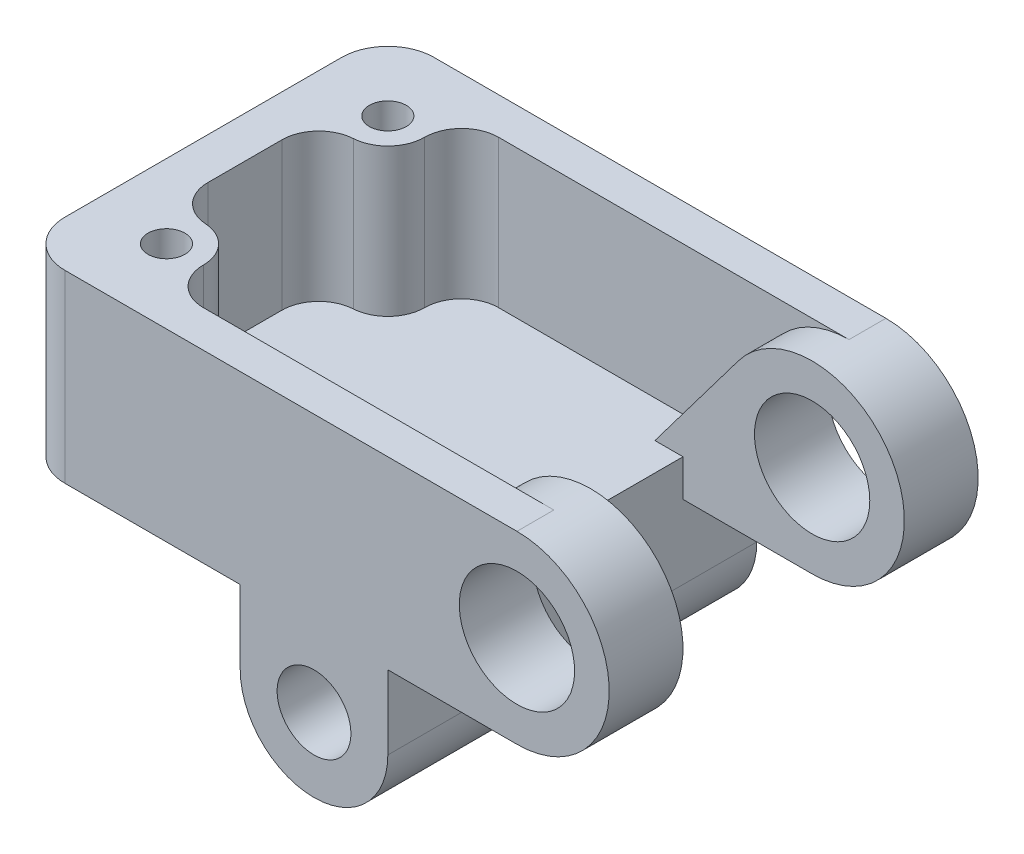
from build123d import *

# Parameters (mm, degrees)
SKETCH1_R                 = 12.5
BOSS_EXTRUDE1_DEPTH       = 16
BOSS_EXTRUDE2_DEPTH       = 8
SKETCH1_6_R               = 8
BOSS_EXTRUDE3_DEPTH       = 80
BOSS_EXTRUDE4_START       = -24
SKETCH1_7_W               = 8
SKETCH1_7_H               = 32
BOSS_EXTRUDE4_DEPTH       = 32
FILLET1_RADIUS            = 16
FILLET1_LENGTH            = 8
F_8_0MM_DOWEL_HOLE1_D     = 8
F_8_0MM_DOWEL_HOLE1_DEPTH = 8
BOSS_EXTRUDE5_REACH       = 169.236
SKETCH3_R                 = 4
FILLET2_R                 = 10


with BuildPart() as part:
    # Sketch1 → Boss-Extrude1 (new body)
    with BuildSketch(Plane.XY):
        with BuildLine():
            Line((80, 8), (80, 0))
            Line((80, 0), (108, 0))
            ThreePointArc((108, 0), (128, 20), (108, 40))
            ThreePointArc((108, 40), (99.076043738, 37.898687232), (92.027289799, 32.036300463))
            Line((92.027289799, 32.036300463), (73.914638236, 8))
            Line((73.914638236, 8), (80, 8))
        make_face()
        with Locations((108, 20)):
            Circle(SKETCH1_R, mode=Mode.SUBTRACT)
    boss_extrude1 = extrude(amount=-BOSS_EXTRUDE1_DEPTH)

    # Sketch1<5> → Boss-Extrude2 (add)
    with BuildSketch(Plane.XY):
        with BuildLine():
            Line((9, 40), (9, 8))
            Line((9, 8), (73.914638236, 8))
            Line((73.914638236, 8), (92.027289799, 32.036300463))
            ThreePointArc((92.027289799, 32.036300463), (99.076043738, 37.898687232), (108, 40))
            Line((108, 40), (9, 40))
        make_face()
    boss_extrude2 = extrude(amount=-BOSS_EXTRUDE2_DEPTH)

    # Sketch1<6> → Boss-Extrude3 (add)
    # profile 1 of 3: a face of its own
    with BuildSketch(Plane.XY):
        Polygon((9, 8), (9, 0), (0, 0), (0, 40), (9, 40), align=None)
    # profile 2 of 3: a face of its own
    with BuildSketch(Plane.XY):
        Polygon((9, 8), (9, 0), (48, 0), (80, 0), (80, 8), (73.914638236, 8), align=None)
    # profile 3 of 3: a face of its own
    with BuildSketch(Plane.XY):
        with BuildLine():
            Line((80, 0), (48, 0))
            Line((48, 0), (48, -16))
            ThreePointArc((48, -16), (64, -32), (80, -16))
            Line((80, -16), (80, 0))
        make_face()
        with Locations((64, -16)):
            Circle(SKETCH1_6_R, mode=Mode.SUBTRACT)
    extrude(amount=-BOSS_EXTRUDE3_DEPTH)

    # Mirror1: Boss-Extrude1, Boss-Extrude2 across plane
    add(boss_extrude1.mirror(Plane.XY.offset(-40)))
    add(boss_extrude2.mirror(Plane.XY.offset(-40)))

    # Sketch1<7> → Boss-Extrude4 (add)
    with BuildSketch(Plane.XY.offset(BOSS_EXTRUDE4_START)):
        with Locations((-4, 16)):
            Rectangle(SKETCH1_7_W, SKETCH1_7_H)
    extrude(amount=-BOSS_EXTRUDE4_DEPTH)

    # Fillet1: full round fillet: the end face becomes a half cylinder, R = half its width
    fillet1_face = Plane((-4, 32, -40), x_dir=(-1, 0, 0), z_dir=(0, 1, 0))  # on the end face: x along it, z out of the body
    fillet1_slab = fillet1_face.offset(-FILLET1_RADIUS / 2) * Box(FILLET1_LENGTH, 2 * FILLET1_RADIUS, FILLET1_RADIUS, mode=Mode.PRIVATE)  # the body's end, R deep
    fillet1_round = Plane((-4, 16, -40), x_dir=(0, 1, 0), z_dir=(-1, 0, 0)) * Cylinder(FILLET1_RADIUS, FILLET1_LENGTH, mode=Mode.PRIVATE)  # its axis R under the face
    add(fillet1_slab - fillet1_round, mode=Mode.SUBTRACT)

    # Ø8.0mm Dowel Hole1
    with Locations(Plane(origin=(-8, 16, -40), x_dir=(0, -1, 0), z_dir=(-1, 0, 0))):
        with Locations((0, 0)):
            Hole(F_8_0MM_DOWEL_HOLE1_D / 2, depth=F_8_0MM_DOWEL_HOLE1_DEPTH)

    # Sketch3 → Boss-Extrude5 (add, up to next)
    with BuildSketch(Plane(origin=(0, 40, 0), x_dir=(1, 0, 0), z_dir=(0, 1, 0)), mode=Mode.PRIVATE) as boss_extrude5_sk1:
        with BuildLine():
            Line((32, 72), (9, 72))
            Line((9, 72), (9, 48.031280577))
            ThreePointArc((9, 48.031280577), (11.169048105, 53.508506152), (16.5, 56.015640289))
            ThreePointArc((16.5, 56.015640289), (21.830951895, 58.522774425), (24, 64))
            ThreePointArc((24, 64), (26.343145751, 69.656854249), (32, 72))
        make_face()
        with Locations(Location((16, 64, 0), (0, 0, 270))):
            Circle(SKETCH3_R, mode=Mode.SUBTRACT)
    boss_extrude5_tool1 = extrude(boss_extrude5_sk1.sketch, amount=-BOSS_EXTRUDE5_REACH, mode=Mode.PRIVATE) - part.part
    # Sketch3 → Boss-Extrude5 (add, up to next)
    with BuildSketch(Plane(origin=(0, 40, 0), x_dir=(1, 0, 0), z_dir=(0, 1, 0)), mode=Mode.PRIVATE) as boss_extrude5_sk2:
        with BuildLine():
            ThreePointArc((16.5, 23.984359711), (11.169048105, 26.491493848), (9, 31.968719423))
            Line((9, 31.968719423), (9, 8))
            Line((9, 8), (32, 8))
            ThreePointArc((32, 8), (26.343145751, 10.343145751), (24, 16))
            ThreePointArc((24, 16), (21.830951895, 21.477225575), (16.5, 23.984359711))
        make_face()
        with Locations(Location((16, 16, 0), (0, 0, 270))):
            Circle(SKETCH3_R, mode=Mode.SUBTRACT)
    boss_extrude5_tool2 = extrude(boss_extrude5_sk2.sketch, amount=-BOSS_EXTRUDE5_REACH, mode=Mode.PRIVATE) - part.part
    add(boss_extrude5_tool1.solids().sort_by_distance((20.5, 40, -71.66781))[0])
    add(boss_extrude5_tool2.solids().sort_by_distance((10.926925, 40, -26.264059))[0])

    # Fillet2
    fillet2_edges = [part.edges().sort_by_distance(p)[0] for p in [
        (0, 20, 0),
        (0, 20, -80),
    ]]
    fillet(fillet2_edges, radius=FILLET2_R)


solid = part.part
